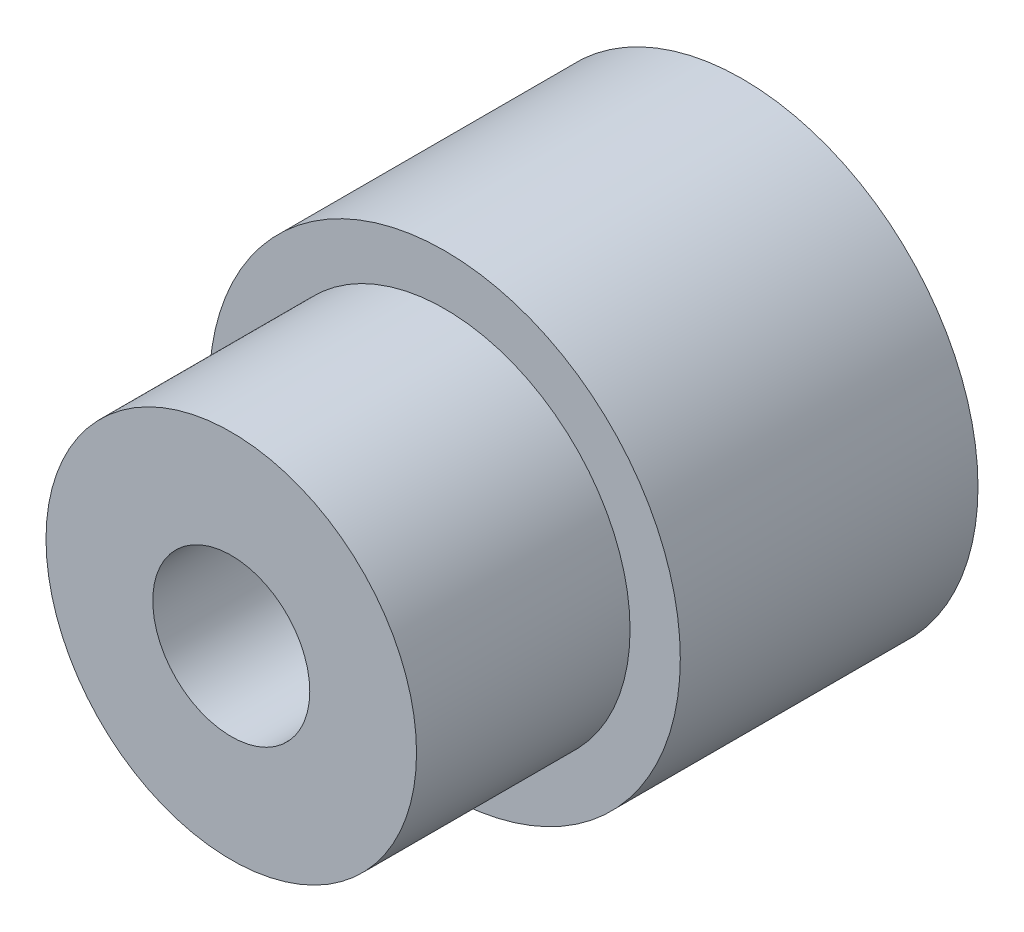
from build123d import *

# Parameters (mm, degrees)
SKETCH1_R           = 4.7625
BOSS_EXTRUDE1_DEPTH = 6.0198
SKETCH2_R           = 3.7465
BOSS_EXTRUDE2_DEPTH = 4.318
SKETCH3_R           = 1.5875
CUT_EXTRUDE1_DEPTH  = 13.338270598


with BuildPart() as part:
    # Sketch1 → Boss-Extrude1 (new body)
    with BuildSketch(Plane.XY):
        Circle(SKETCH1_R)
    extrude(amount=BOSS_EXTRUDE1_DEPTH)

    # Sketch2 → Boss-Extrude2 (add)
    with BuildSketch(Plane.XY.offset(6.0198)):
        Circle(SKETCH2_R)
    extrude(amount=BOSS_EXTRUDE2_DEPTH)

    # Sketch3 → Cut-Extrude1 (cut, through all)
    with BuildSketch(Plane.XY.offset(10.3378)):
        Circle(SKETCH3_R)
    extrude(amount=-CUT_EXTRUDE1_DEPTH, mode=Mode.SUBTRACT)


solid = part.part
